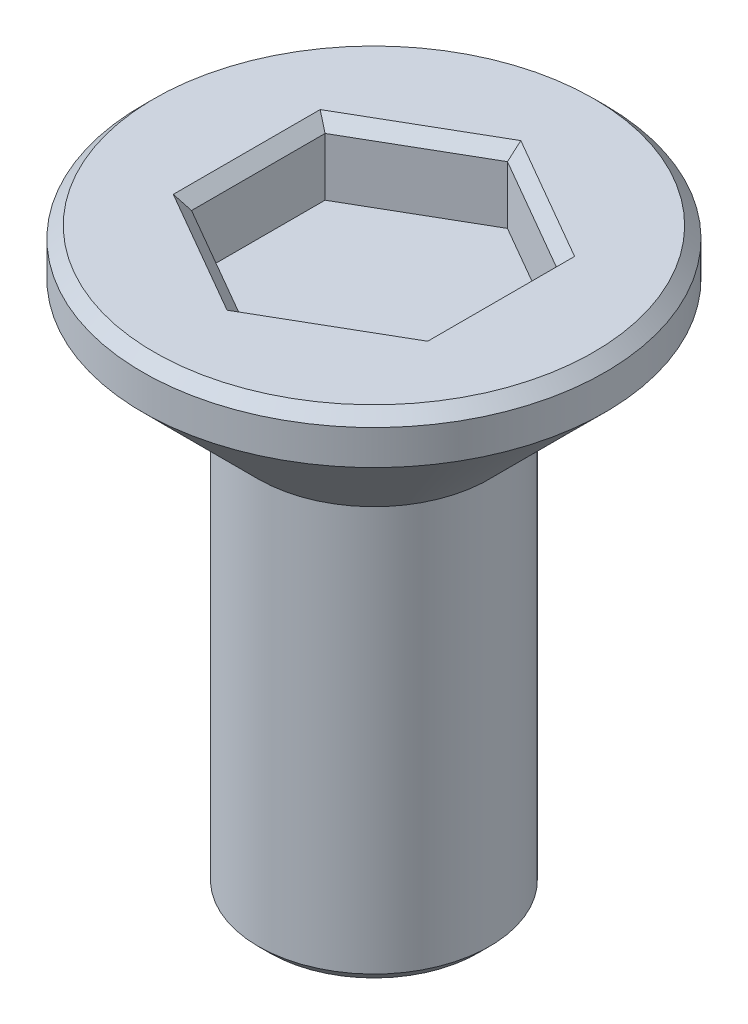
from build123d import *

# Parameters (mm, degrees)
CUT_EXTRUDE1_DEPTH = 0.6
CHAMFER1_SIZE      = 0.1
CHAMFER2_SIZE      = 0.1


with BuildPart() as part:
    # Sketch1 → Revolve1 (revolve)
    with BuildSketch(Plane(origin=(0, 0, 0), x_dir=(0, 0, -1), z_dir=(1, 0, 0)), mode=Mode.PRIVATE) as revolve1_sk:
        Polygon((0, 5), (-2, 5), (-2, 4.6), (-1, 3.6), (-1, 0), (0, 0), align=None)
    revolve(revolve1_sk.sketch.rotate(Axis((0, 0, 0), (0, 1, 0)), 180), axis=Axis((0, 0, 0), (0, 1, 0)))

    # Sketch2 → Cut-Extrude1 (cut)
    with BuildSketch(Plane(origin=(0, 5, 0), x_dir=(1, 0, 0), z_dir=(0, 1, 0))):
        Polygon((0, -1.154700538), (1, -0.577350269), (1, 0.577350269), (0, 1.154700538), (-1, 0.577350269), (-1, -0.577350269), align=None)
    extrude(amount=-CUT_EXTRUDE1_DEPTH, mode=Mode.SUBTRACT)

    # Chamfer1
    chamfer1_edges = [part.edges().sort_by_distance(p)[0] for p in [
        (0, 0, 1),
    ]]
    chamfer(chamfer1_edges, length=CHAMFER1_SIZE)

    # Chamfer2
    chamfer2_edges = [part.edges().sort_by_distance(p)[0] for p in [
        (-0.5, 5, 0.866025404),
        (0.5, 5, 0.866025404),
        (1, 5, 0),
        (0.5, 5, -0.866025404),
        (-0.5, 5, -0.866025404),
        (-1, 5, 0),
        (0, 5, 2),
    ]]
    chamfer(chamfer2_edges, length=CHAMFER2_SIZE)


solid = part.part
